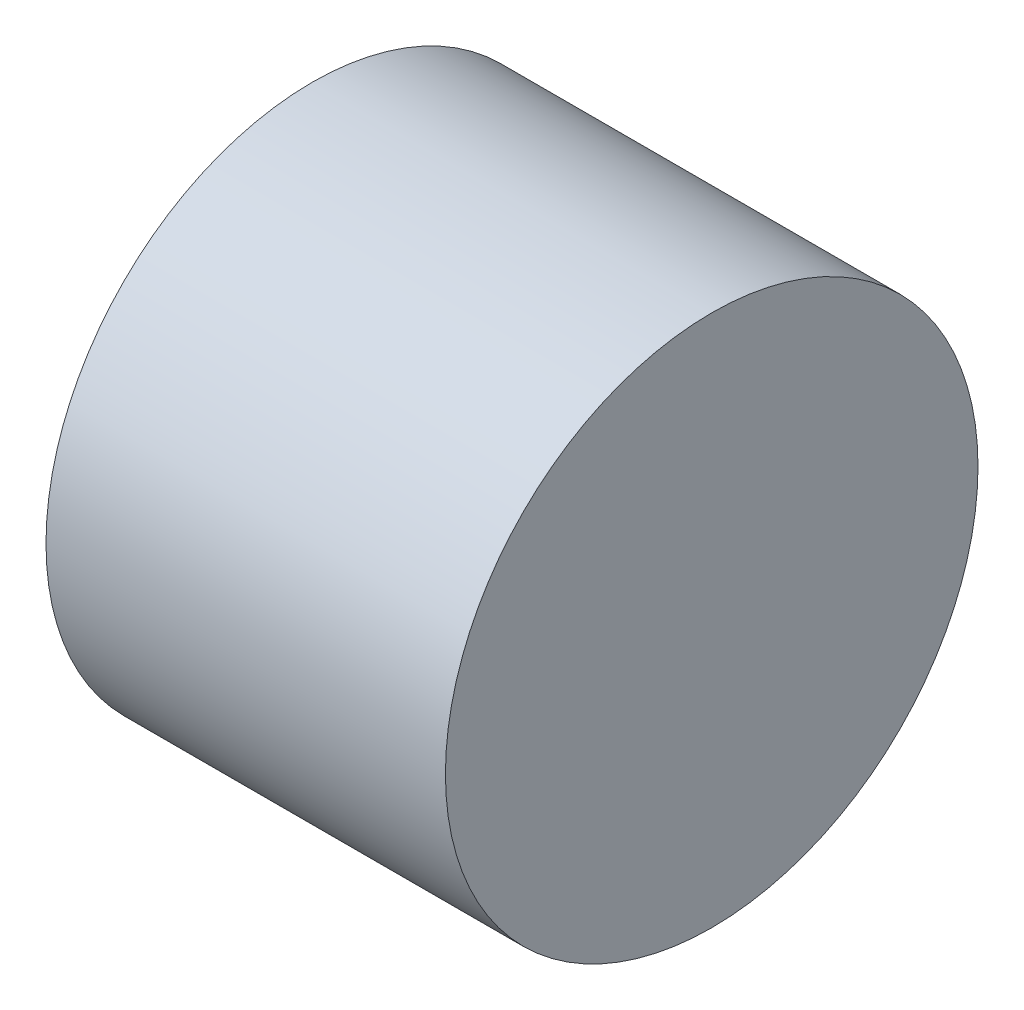
from build123d import *

# Parameters (mm, degrees)
SKETCH1_R      = 20
EXTRUDE1_DEPTH = 30


with BuildPart() as part:
    # Sketch1 → Extrude1 (new body)
    with BuildSketch(Plane(origin=(0, 0, 0), x_dir=(0, 0, -1), z_dir=(1, 0, 0))):
        Circle(SKETCH1_R)
    extrude(amount=EXTRUDE1_DEPTH)


solid = part.part
